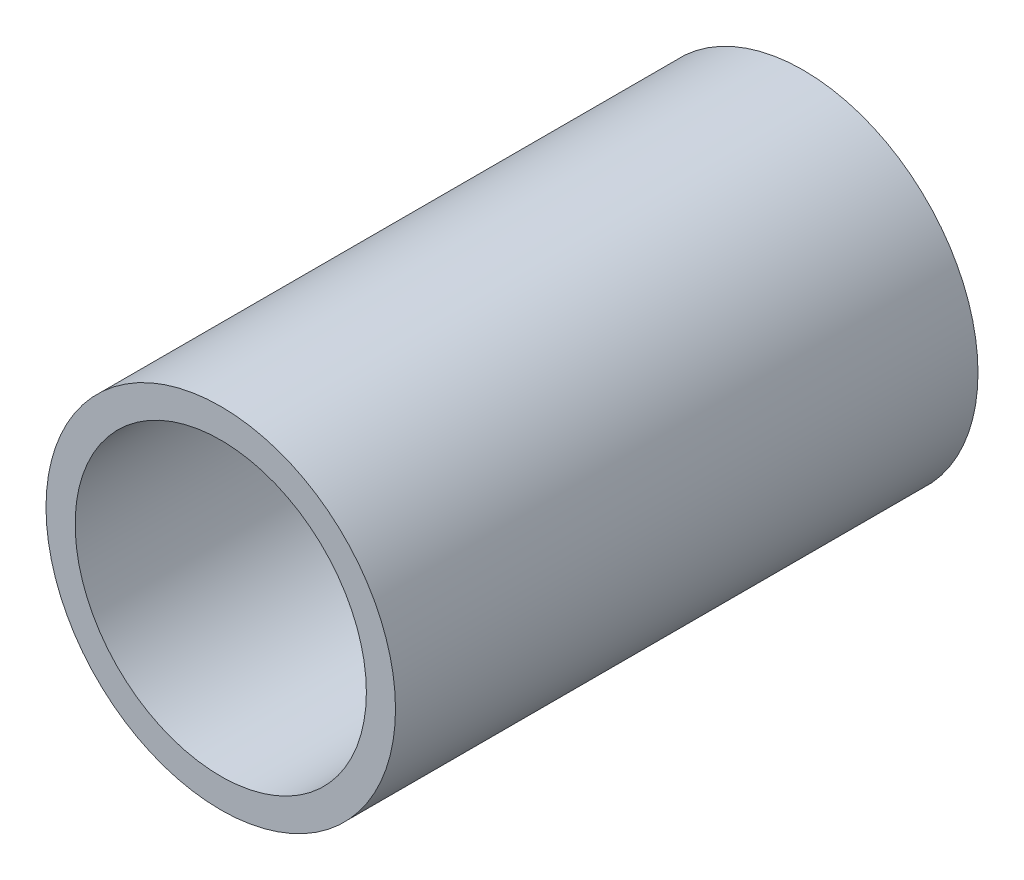
from build123d import *

# Parameters (mm, degrees)
SKETCH1_R           = 7.5
SKETCH1_R_2         = 6.25
BOSS_EXTRUDE1_DEPTH = 25


with BuildPart() as part:
    # Sketch1 → Boss-Extrude1 (new body)
    with BuildSketch(Plane.XY):
        Circle(SKETCH1_R)
        Circle(SKETCH1_R_2, mode=Mode.SUBTRACT)
    extrude(amount=BOSS_EXTRUDE1_DEPTH)


solid = part.part
